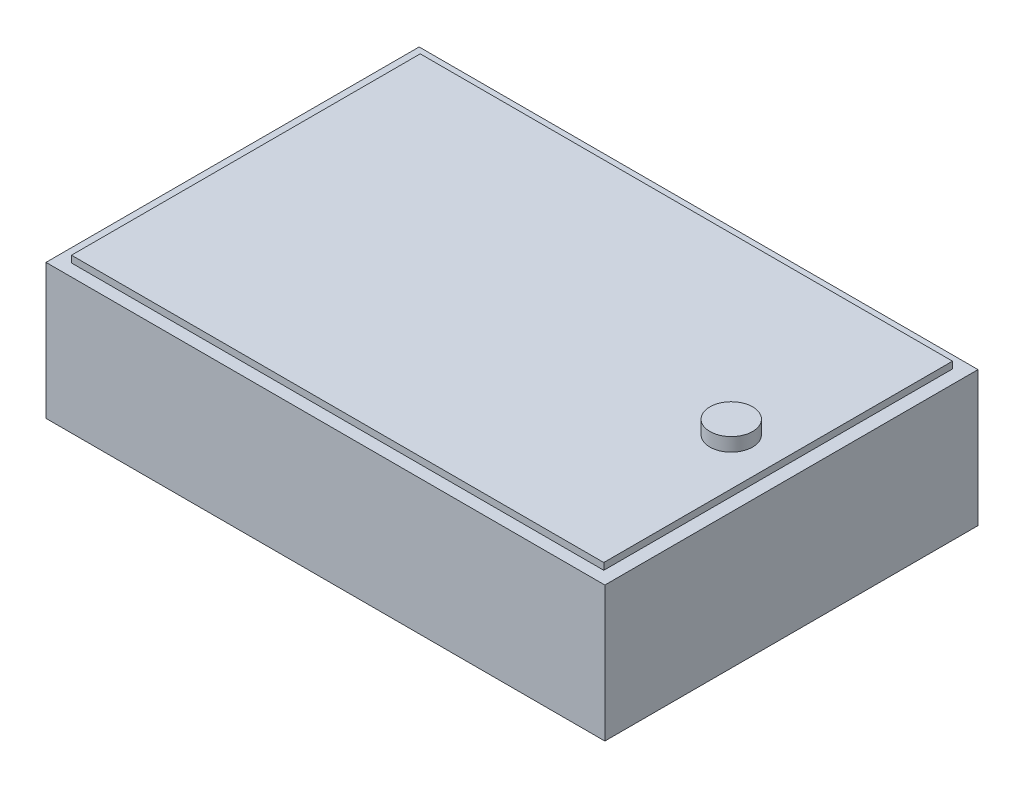
from build123d import *

# Parameters (mm, degrees)
SKETCH1_W           = 248.117447686
SKETCH1_H           = 165.663783668
BOSS_EXTRUDE1_DEPTH = 60
SKETCH2_W           = 236.316367542
SKETCH2_H           = 154.827964942
BOSS_EXTRUDE2_DEPTH = 3
SKETCH3_R           = 9.48321581
BOSS_EXTRUDE3_DEPTH = 6
SKETCH4_R           = 22.698755204
SKETCH4_R_2         = 22.820518268
CUT_EXTRUDE1_DEPTH  = 15


with BuildPart() as part:
    # Sketch1 → Boss-Extrude1 (new body)
    with BuildSketch(Plane(origin=(0, 0, 0), x_dir=(1, 0, 0), z_dir=(0, 1, 0))):
        Rectangle(SKETCH1_W, SKETCH1_H)
    extrude(amount=BOSS_EXTRUDE1_DEPTH)

    # Sketch2 → Boss-Extrude2 (add)
    with BuildSketch(Plane(origin=(0, 60, 0), x_dir=(1, 0, 0), z_dir=(0, 1, 0))):
        Rectangle(SKETCH2_W, SKETCH2_H)
    extrude(amount=BOSS_EXTRUDE2_DEPTH)

    # Sketch3 → Boss-Extrude3 (add)
    with BuildSketch(Plane(origin=(0, 63, 0), x_dir=(1, 0, 0), z_dir=(0, 1, 0))):
        with Locations(Location((97.343283416, 0, 0), (0, 0, 270))):
            Circle(SKETCH3_R)
    extrude(amount=BOSS_EXTRUDE3_DEPTH)

    # Sketch4 → Cut-Extrude1 (cut)
    with BuildSketch(Plane(origin=(0, 0, -82.831891834), x_dir=(-1, 0, 0), z_dir=(0, 0, -1))):
        with Locations((-83.93255151, 31.205001036)):
            Circle(SKETCH4_R)
        with Locations((0, 31.205001036)):
            Circle(SKETCH4_R_2)
        with Locations((81.942967289, 31.205001036)):
            Circle(SKETCH4_R)
    extrude(amount=-CUT_EXTRUDE1_DEPTH, mode=Mode.SUBTRACT)


solid = part.part
